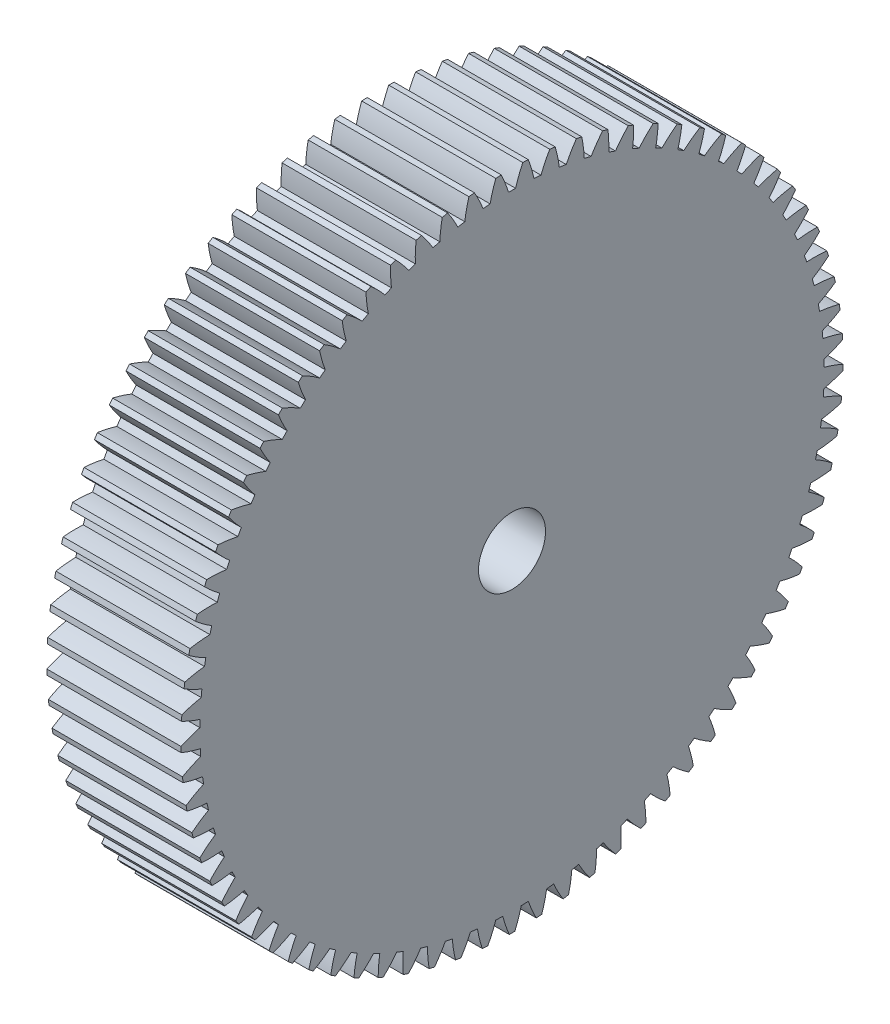
from build123d import *

# Parameters (mm, degrees)
BASPROSKE_W     = 8
BASPROSKE_H     = 19.75
TOOTHCUT_DEPTH  = 30.053829352
TEETHCUTS_COUNT = 77
TEETHCUTS_ANGLE = 355.324675325
BORSKE_R        = 2
BORE_DEPTH      = 50.0000508


with BuildPart() as part:
    # BasProSke → Base-Revolve (revolve)
    with BuildSketch(Plane(origin=(0, 0, 0), x_dir=(1, 0, 0), z_dir=(0, 1, 0)), mode=Mode.PRIVATE) as base_revolve_sk:
        with Locations((4, 9.875)):
            Rectangle(BASPROSKE_W, BASPROSKE_H)
    revolve(base_revolve_sk.sketch.rotate(Axis((-10, 0, 0), (1, 0, 0)), 180), axis=Axis((-10, 0, 0), (1, 0, 0)))

    # TooCutSke → ToothCut (cut, through all)
    with BuildSketch(Plane(origin=(0, 0, 0), x_dir=(0, 0, -1), z_dir=(1, 0, 0))):
        with BuildLine():
            ThreePointArc((0.210695964, 18.622808145), (0, 18.624), (-0.210695964, 18.622808145))
            ThreePointArc((-0.210695964, 18.622808145), (-0.409199993, 19.202518987), (-0.653171502, 19.764610094))
            ThreePointArc((-0.653171502, 19.764610094), (0, 19.7754), (0.653171502, 19.764610094))
            ThreePointArc((0.653171502, 19.764610094), (0.409199993, 19.202518987), (0.210695964, 18.622808145))
        make_face()
    toothcut = extrude(amount=TOOTHCUT_DEPTH, mode=Mode.SUBTRACT)

    # TeethCuts: ToothCut ×77 about axis
    teethcuts_axis = Axis((-10, 0, 0), (1, 0, 0))
    for i in range(1, TEETHCUTS_COUNT):
        add(toothcut.rotate(teethcuts_axis, i * TEETHCUTS_ANGLE / (TEETHCUTS_COUNT - 1)), mode=Mode.SUBTRACT)

    # BorSke → Bore (cut, symmetric)
    with BuildSketch(Plane(origin=(0, 0, 0), x_dir=(0, 0, -1), z_dir=(1, 0, 0))):
        with Locations(Location((0, 0, 0), (0, 0, 180))):
            Circle(BORSKE_R)
    extrude(amount=BORE_DEPTH, both=True, mode=Mode.SUBTRACT)


solid = part.part
